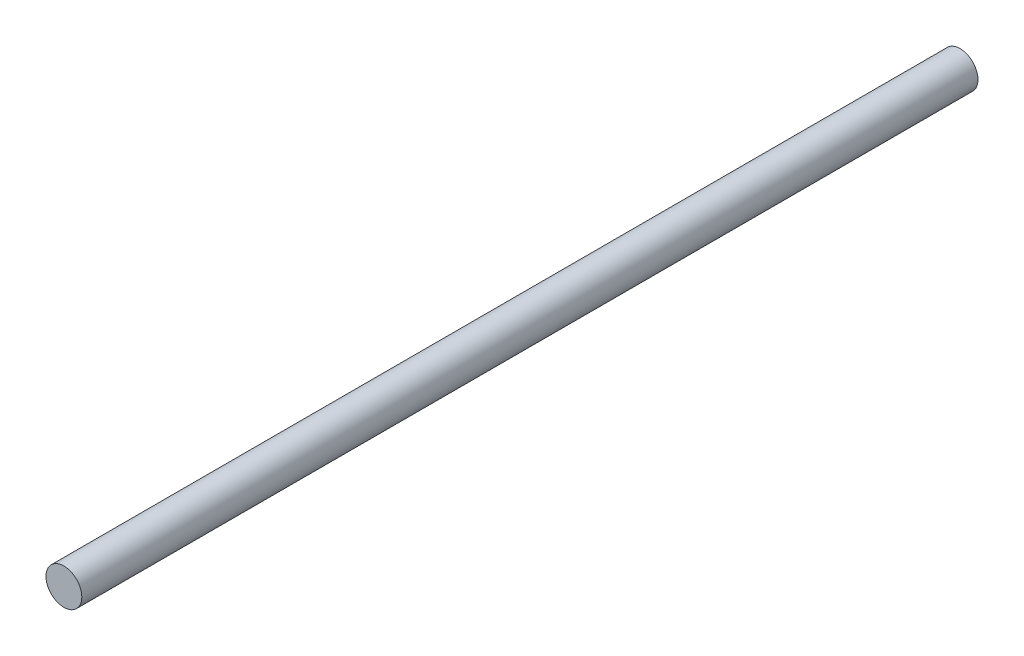
from build123d import *

# Parameters (mm, degrees)
SKETCH1_R           = 2.5
BOSS_EXTRUDE1_DEPTH = 62.5


with BuildPart() as part:
    # Sketch1 → Boss-Extrude1 (new, symmetric)
    with BuildSketch(Plane.XY):
        Circle(SKETCH1_R)
    extrude(amount=BOSS_EXTRUDE1_DEPTH, both=True)


solid = part.part
